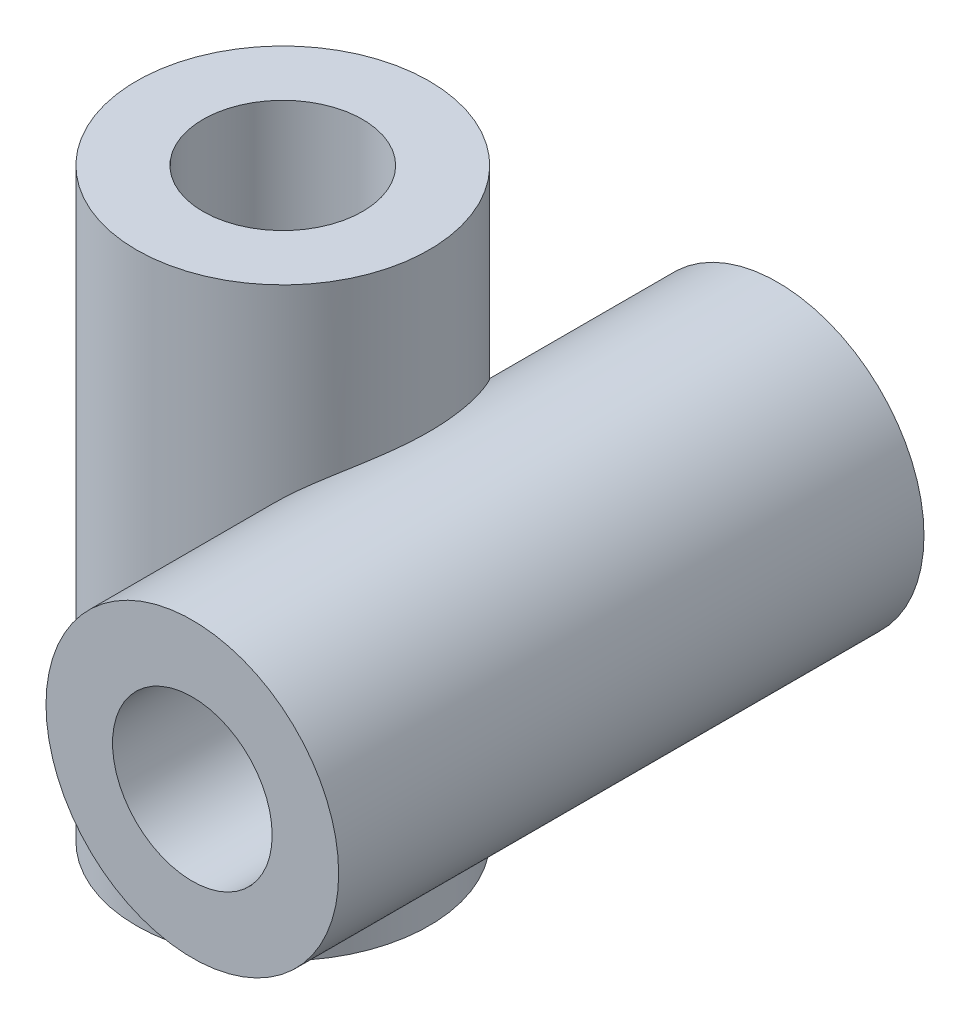
from build123d import *

# Parameters (mm, degrees)
SKETCH2_R           = 27.5
SKETCH2_R_2         = 15
BOSS_EXTRUDE1_DEPTH = 110
SKETCH3_R           = 27.5
SKETCH3_R_2         = 15
BOSS_EXTRUDE2_DEPTH = 55


with BuildPart() as part:
    # Sketch2 → Boss-Extrude1 (new body)
    with BuildSketch(Plane(origin=(0, 0, 0), x_dir=(1, 0, 0), z_dir=(0, 1, 0))):
        with Locations(Location((0, 0, 0), (0, 0, 270))):
            Circle(SKETCH2_R)
        with Locations(Location((0, 0, 0), (0, 0, 270))):
            Circle(SKETCH2_R_2, mode=Mode.SUBTRACT)
    extrude(amount=BOSS_EXTRUDE1_DEPTH)

    # Sketch3 → Boss-Extrude2 (add, symmetric)
    with BuildSketch(Plane.XY):
        with Locations((38, 55)):
            Circle(SKETCH3_R)
        with Locations((38, 55)):
            Circle(SKETCH3_R_2, mode=Mode.SUBTRACT)
    extrude(amount=BOSS_EXTRUDE2_DEPTH, both=True)


solid = part.part
